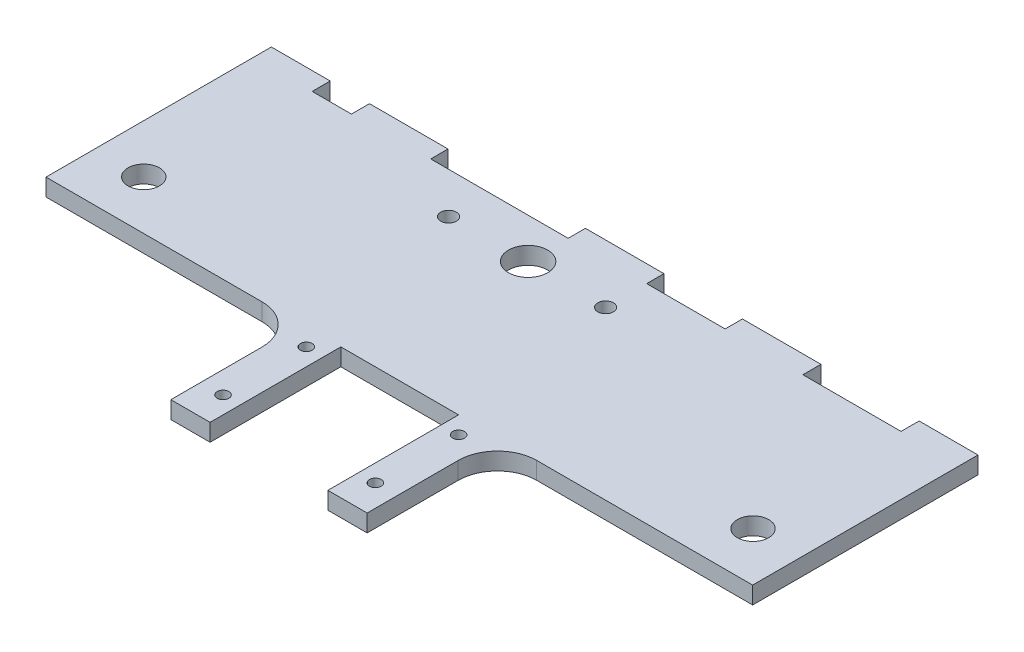
from build123d import *

# Parameters (mm, degrees)
BOSS_EXTRUDE1_DEPTH   = 5.588
F_6_CLEARANCE_HOLE1_D = 3.7973
CUT_EXTRUDE1_REACH    = 254.133
SKETCH5_R             = 5.08
CUT_EXTRUDE2_REACH    = 254.133
SKETCH6_R             = 6.35
CUT_EXTRUDE3_REACH    = 254.133
SKETCH7_R             = 2.54


with BuildPart() as part:
    # Sketch1 → Boss-Extrude1 (new body)
    with BuildSketch(Plane(origin=(0, 0, 0), x_dir=(1, 0, 0), z_dir=(0, 1, 0))):
        with BuildLine():
            Line((12.7, 72.898), (31.75, 72.898))
            Line((31.75, 72.898), (31.75, 67.056))
            Line((31.75, 67.056), (44.45, 67.056))
            Line((44.45, 67.056), (44.45, 72.898))
            Line((44.45, 72.898), (69.85, 72.898))
            Line((69.85, 72.898), (69.85, 67.31))
            Line((69.85, 67.31), (114.3, 67.31))
            Line((114.3, 67.31), (114.3, 72.898))
            Line((114.3, 72.898), (139.7, 72.898))
            Line((139.7, 72.898), (139.7, 67.31))
            Line((139.7, 67.31), (165.1, 67.31))
            Line((165.1, 67.31), (165.1, 72.898))
            Line((165.1, 72.898), (190.5, 72.898))
            Line((190.5, 72.898), (190.5, 67.056))
            Line((190.5, 67.056), (222.25, 67.056))
            Line((222.25, 67.056), (222.25, 72.898))
            Line((222.25, 72.898), (241.3, 72.898))
            Line((241.3, 72.898), (241.3, 0))
            Line((241.3, 0), (171.45, 0))
            ThreePointArc((171.45, 0), (162.469743879, -3.719743879), (158.75, -12.7))
            Line((158.75, -12.7), (158.75, -42.164))
            Line((158.75, -42.164), (146.05, -42.164))
            Line((146.05, -42.164), (146.05, 0.122766638))
            Line((146.05, 0.122766638), (127, 0.122766638))
            Line((127, 0.122766638), (107.95, 0.122766638))
            Line((107.95, 0.122766638), (107.95, -42.164))
            Line((107.95, -42.164), (95.25, -42.164))
            Line((95.25, -42.164), (95.25, -12.7))
            ThreePointArc((95.25, -12.7), (91.530256121, -3.719743879), (82.55, 0))
            Line((82.55, 0), (12.7, 0))
            Line((12.7, 0), (12.7, 72.898))
        make_face()
    extrude(amount=BOSS_EXTRUDE1_DEPTH)

    # #6 Clearance Hole1 (through all)
    with Locations(Plane(origin=(0, 0, 0), x_dir=(-1, 0, 0), z_dir=(0, -1, 0))):
        with Locations((-102.362, -32.397617544), (-151.638, -32.397617544), (-151.638, -5.456849181), (-102.362, -5.456849181)):
            Hole(F_6_CLEARANCE_HOLE1_D / 2)

    # Sketch5 → Cut-Extrude1 (cut, up to next)
    with BuildSketch(Plane(origin=(0, 5.588, 0), x_dir=(1, 0, 0), z_dir=(0, 1, 0)), mode=Mode.PRIVATE) as cut_extrude1_sk1:
        with Locations(Location((225.552, 15.870766638, 0), (0, 0, 270))):
            Circle(SKETCH5_R)
    cut_extrude1_tool1 = extrude(cut_extrude1_sk1.sketch, amount=-CUT_EXTRUDE1_REACH, mode=Mode.PRIVATE) & part.part
    # Sketch5 → Cut-Extrude1 (cut, up to next)
    with BuildSketch(Plane(origin=(0, 5.588, 0), x_dir=(1, 0, 0), z_dir=(0, 1, 0)), mode=Mode.PRIVATE) as cut_extrude1_sk2:
        with Locations(Location((28.448, 15.870766638, 0), (0, 0, 270))):
            Circle(SKETCH5_R)
    cut_extrude1_tool2 = extrude(cut_extrude1_sk2.sketch, amount=-CUT_EXTRUDE1_REACH, mode=Mode.PRIVATE) & part.part
    add(cut_extrude1_tool1.solids().sort_by_distance((225.552, 5.588, -15.870767))[0], mode=Mode.SUBTRACT)
    add(cut_extrude1_tool2.solids().sort_by_distance((28.448, 5.588, -15.870767))[0], mode=Mode.SUBTRACT)

    # Sketch6 → Cut-Extrude2 (cut, up to next)
    with BuildSketch(Plane.XZ, mode=Mode.PRIVATE) as cut_extrude2_sk1:
        with Locations(Location((114.3, -54.356, 0), (0, 0, 270))):
            Circle(SKETCH6_R)
    cut_extrude2_tool1 = extrude(cut_extrude2_sk1.sketch, amount=-CUT_EXTRUDE2_REACH, mode=Mode.PRIVATE) & part.part
    add(cut_extrude2_tool1.solids().sort_by_distance((114.3, 0, -54.356))[0], mode=Mode.SUBTRACT)

    # Sketch7 → Cut-Extrude3 (cut, up to next)
    with BuildSketch(Plane(origin=(0, 5.588, 0), x_dir=(1, 0, 0), z_dir=(0, 1, 0)), mode=Mode.PRIVATE) as cut_extrude3_sk1:
        with Locations(Location((139.7, 54.020508314, 0), (0, 0, 270))):
            Circle(SKETCH7_R)
    cut_extrude3_tool1 = extrude(cut_extrude3_sk1.sketch, amount=-CUT_EXTRUDE3_REACH, mode=Mode.PRIVATE) & part.part
    # Sketch7 → Cut-Extrude3 (cut, up to next)
    with BuildSketch(Plane(origin=(0, 5.588, 0), x_dir=(1, 0, 0), z_dir=(0, 1, 0)), mode=Mode.PRIVATE) as cut_extrude3_sk2:
        with Locations(Location((88.9, 54.020508314, 0), (0, 0, 270))):
            Circle(SKETCH7_R)
    cut_extrude3_tool2 = extrude(cut_extrude3_sk2.sketch, amount=-CUT_EXTRUDE3_REACH, mode=Mode.PRIVATE) & part.part
    add(cut_extrude3_tool1.solids().sort_by_distance((139.7, 5.588, -54.020508))[0], mode=Mode.SUBTRACT)
    add(cut_extrude3_tool2.solids().sort_by_distance((88.9, 5.588, -54.020508))[0], mode=Mode.SUBTRACT)


solid = part.part
